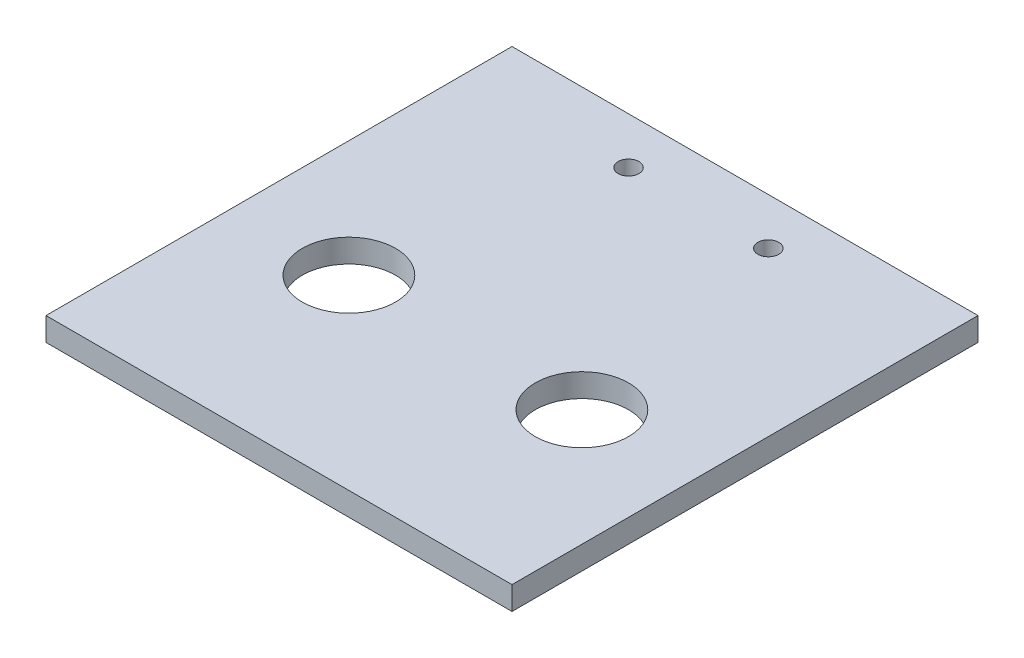
from build123d import *

# Parameters (mm, degrees)
SKETCH1_W           = 63.5
SKETCH1_H           = 63.5
SKETCH1_R           = 6.35
SKETCH1_R_2         = 1.4224
BOSS_EXTRUDE1_DEPTH = 3.175


with BuildPart() as part:
    # Sketch1 → Boss-Extrude1 (new body)
    with BuildSketch(Plane(origin=(0, 0, 0), x_dir=(1, 0, 0), z_dir=(0, 1, 0))):
        with Locations((31.75, 31.75)):
            Rectangle(SKETCH1_W, SKETCH1_H)
        with Locations(Location((15.875, 25.4, 0), (0, 0, 270))):
            Circle(SKETCH1_R, mode=Mode.SUBTRACT)
        with Locations(Location((47.625, 25.4, 0), (0, 0, 270))):
            Circle(SKETCH1_R, mode=Mode.SUBTRACT)
        with Locations(Location((22.225, 57.15, 0), (0, 0, 270))):
            Circle(SKETCH1_R_2, mode=Mode.SUBTRACT)
        with Locations(Location((41.275, 57.15, 0), (0, 0, 270))):
            Circle(SKETCH1_R_2, mode=Mode.SUBTRACT)
    extrude(amount=BOSS_EXTRUDE1_DEPTH)


solid = part.part
